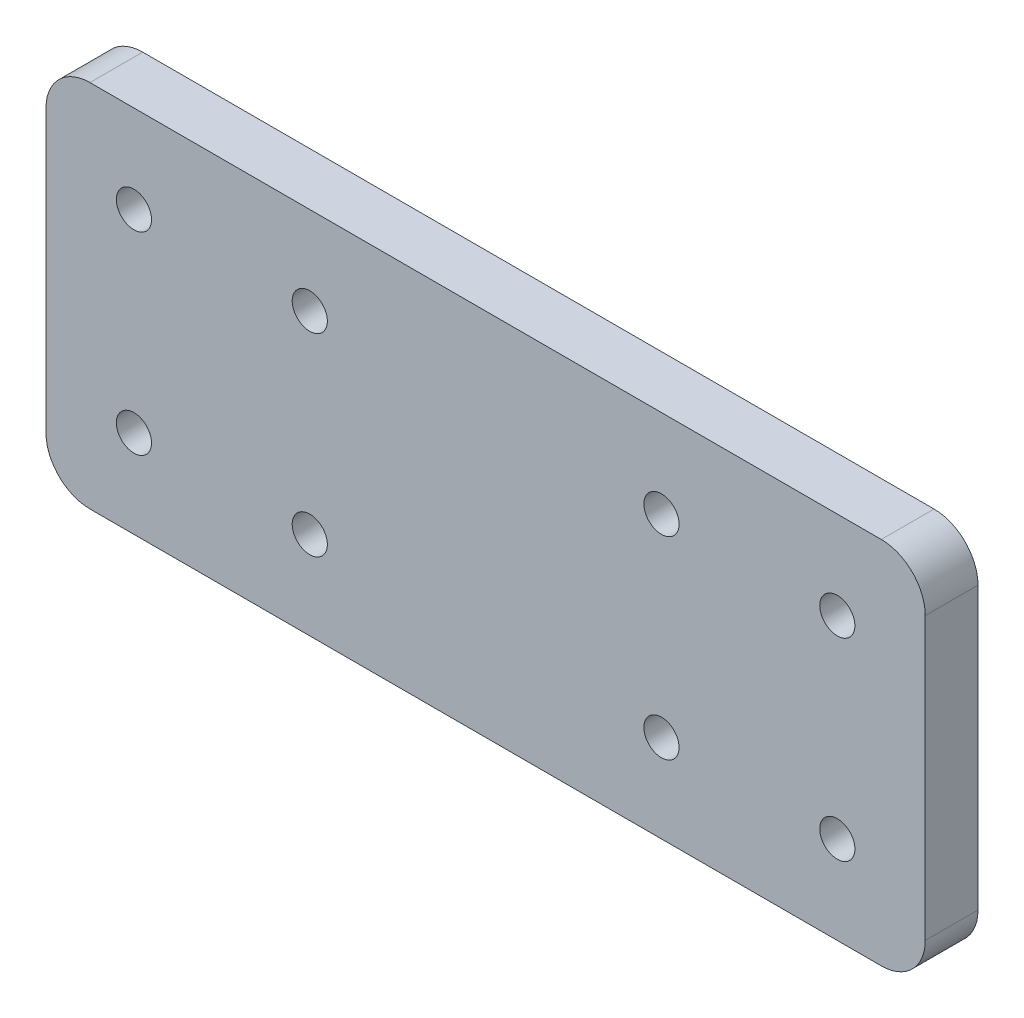
from build123d import *

# Parameters (mm, degrees)
SKETCH_1_R      = 2
EXTRUDE_1_DEPTH = 6


with BuildPart() as part:
    # Эскиз1 → Бобышка-Вытянуть1 (new body)
    with BuildSketch(Plane.XY):
        with BuildLine():
            Line((45, -21), (-45, -21))
            ThreePointArc((-45, -21), (-48.535533906, -19.535533906), (-50, -16))
            Line((-50, -16), (-50, 16))
            ThreePointArc((-50, 16), (-48.535533906, 19.535533906), (-45, 21))
            Line((-45, 21), (45, 21))
            ThreePointArc((45, 21), (48.535533906, 19.535533906), (50, 16))
            Line((50, 16), (50, -16))
            ThreePointArc((50, -16), (48.535533906, -19.535533906), (45, -21))
        make_face()
        with Locations((-40, 11)):
            Circle(SKETCH_1_R, mode=Mode.SUBTRACT)
        with Locations((-20, 11)):
            Circle(SKETCH_1_R, mode=Mode.SUBTRACT)
        with Locations(Location((-40, -11, 0), (0, 0, 180))):
            Circle(SKETCH_1_R, mode=Mode.SUBTRACT)
        with Locations(Location((-20, -11, 0), (0, 0, 180))):
            Circle(SKETCH_1_R, mode=Mode.SUBTRACT)
        with Locations((20, -11)):
            Circle(SKETCH_1_R, mode=Mode.SUBTRACT)
        with Locations((40, -11)):
            Circle(SKETCH_1_R, mode=Mode.SUBTRACT)
        with Locations(Location((40, 11, 0), (0, 0, 180))):
            Circle(SKETCH_1_R, mode=Mode.SUBTRACT)
        with Locations(Location((20, 11, 0), (0, 0, 180))):
            Circle(SKETCH_1_R, mode=Mode.SUBTRACT)
    extrude(amount=EXTRUDE_1_DEPTH)


solid = part.part
